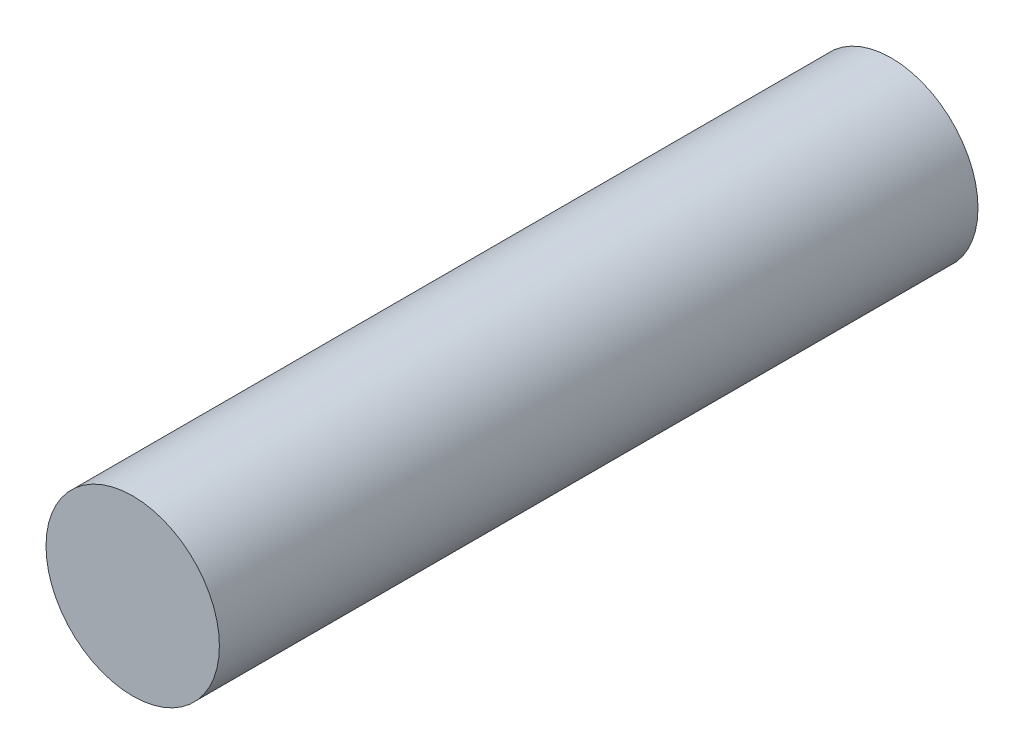
from build123d import *

# Parameters (mm, degrees)
SKETCH1_R           = 4
BOSS_EXTRUDE1_DEPTH = 35


with BuildPart() as part:
    # Sketch1 → Boss-Extrude1 (new body)
    with BuildSketch(Plane.XY):
        Circle(SKETCH1_R)
    extrude(amount=BOSS_EXTRUDE1_DEPTH)


solid = part.part
